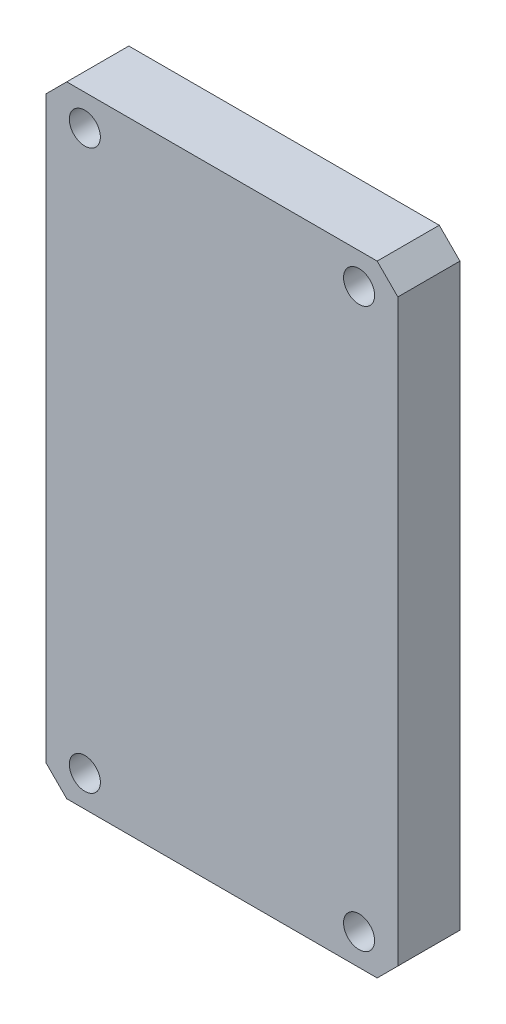
from build123d import *

# Parameters (mm, degrees)
SKETCH2_W           = 34
SKETCH2_H           = 60
BOSS_EXTRUDE1_DEPTH = 6
SKETCH3_R           = 1.5
CUT_EXTRUDE1_DEPTH  = 70.2242732
CHAMFER1_SIZE       = 2


with BuildPart() as part:
    # Sketch2 → Boss-Extrude1 (new body)
    with BuildSketch(Plane.XY):
        with Locations((17, 30)):
            Rectangle(SKETCH2_W, SKETCH2_H)
    extrude(amount=BOSS_EXTRUDE1_DEPTH)

    # Sketch3 → Cut-Extrude1 (cut, through all)
    with BuildSketch(Plane.XY.offset(6)):
        with Locations((3.75, 57)):
            Circle(SKETCH3_R)
        with Locations((30.25, 57)):
            Circle(SKETCH3_R)
        with Locations((3.75, 3)):
            Circle(SKETCH3_R)
        with Locations((30.25, 3)):
            Circle(SKETCH3_R)
    extrude(amount=-CUT_EXTRUDE1_DEPTH, mode=Mode.SUBTRACT)

    # Chamfer1
    chamfer1_edges = [part.edges().sort_by_distance(p)[0] for p in [
        (0, 60, 3),
        (34, 60, 3),
        (34, 0, 3),
        (0, 0, 3),
    ]]
    chamfer(chamfer1_edges, length=CHAMFER1_SIZE)


solid = part.part
